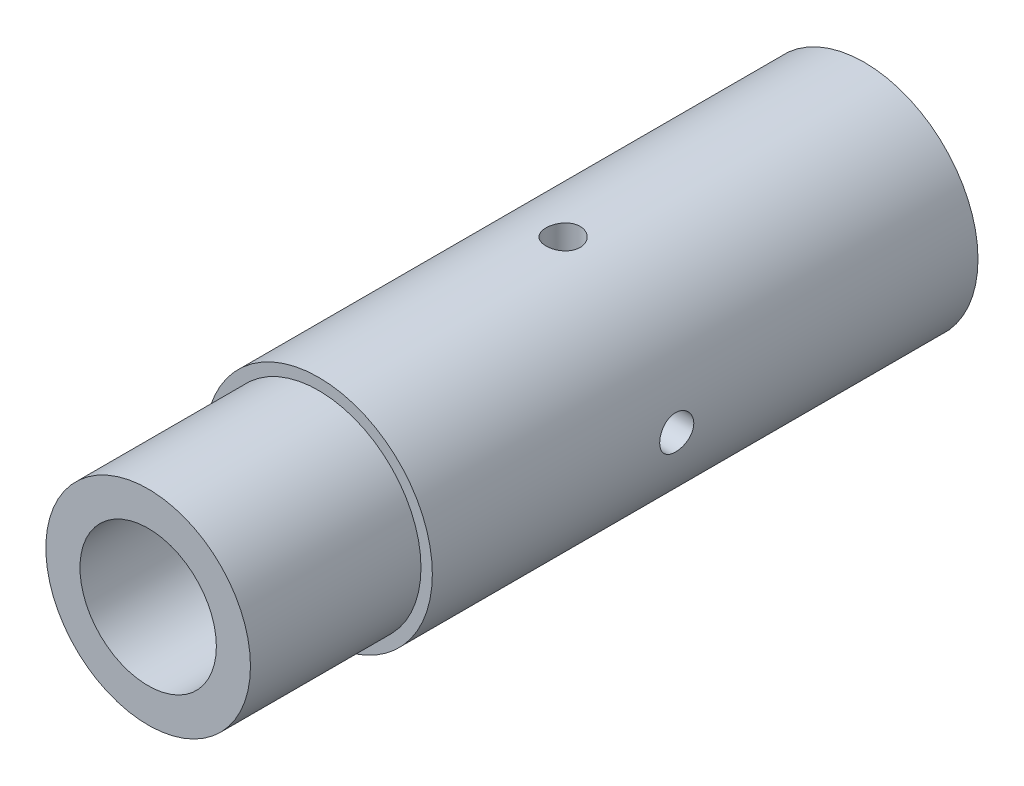
from build123d import *

# Parameters (mm, degrees)
SKETCH_1_R               = 10
EXTRUDE_1_DEPTH          = 63
SKETCH_2_OUTSIDE_W       = 35.812
SKETCH_2_OUTSIDE_H       = 35.812
SKETCH_2_OUTSIDE_R       = 9
CUT_EXTRUDE_1_DEPTH      = 15
SKETCH_3_R               = 6
CUT_EXTRUDE_2_DEPTH      = 65.567793829
SKETCH_4_R               = 1.5
CUT_EXTRUDE_3_DEPTH      = 65.567793829
PATTERN_CIRCULAR_1_COUNT = 2
PATTERN_CIRCULAR_1_ANGLE = 90


with BuildPart() as part:
    # 草图1 → 凸台-拉伸1 (new body)
    with BuildSketch(Plane.XY):
        Circle(SKETCH_1_R)
    extrude(amount=EXTRUDE_1_DEPTH)

    # 草图2 outside → 切除-拉伸1 (cut)
    with BuildSketch(Plane.XY.offset(63)):
        Rectangle(SKETCH_2_OUTSIDE_W, SKETCH_2_OUTSIDE_H)
        Circle(SKETCH_2_OUTSIDE_R, mode=Mode.SUBTRACT)
    extrude(amount=-CUT_EXTRUDE_1_DEPTH, mode=Mode.SUBTRACT)

    # 草图3 → 切除-拉伸2 (cut, through all)
    with BuildSketch(Plane.XY.offset(63)):
        Circle(SKETCH_3_R)
    extrude(amount=-CUT_EXTRUDE_2_DEPTH, mode=Mode.SUBTRACT)

    # 草图4 → 切除-拉伸3 (cut, symmetric)
    with BuildSketch(Plane(origin=(0, 0, 0), x_dir=(0, 0, -1), z_dir=(1, 0, 0))):
        with Locations((-26.5, 0)):
            Circle(SKETCH_4_R)
    cut_extrude_3 = extrude(amount=CUT_EXTRUDE_3_DEPTH, both=True, mode=Mode.SUBTRACT)

    # 阵列(圆周)1: 切除-拉伸3 ×2 about axis
    pattern_circular_1_axis = Axis((0, 0, 63), (0, 0, 1))
    for i in range(1, PATTERN_CIRCULAR_1_COUNT):
        add(cut_extrude_3.rotate(pattern_circular_1_axis, i * PATTERN_CIRCULAR_1_ANGLE / (PATTERN_CIRCULAR_1_COUNT - 1)), mode=Mode.SUBTRACT)


solid = part.part
